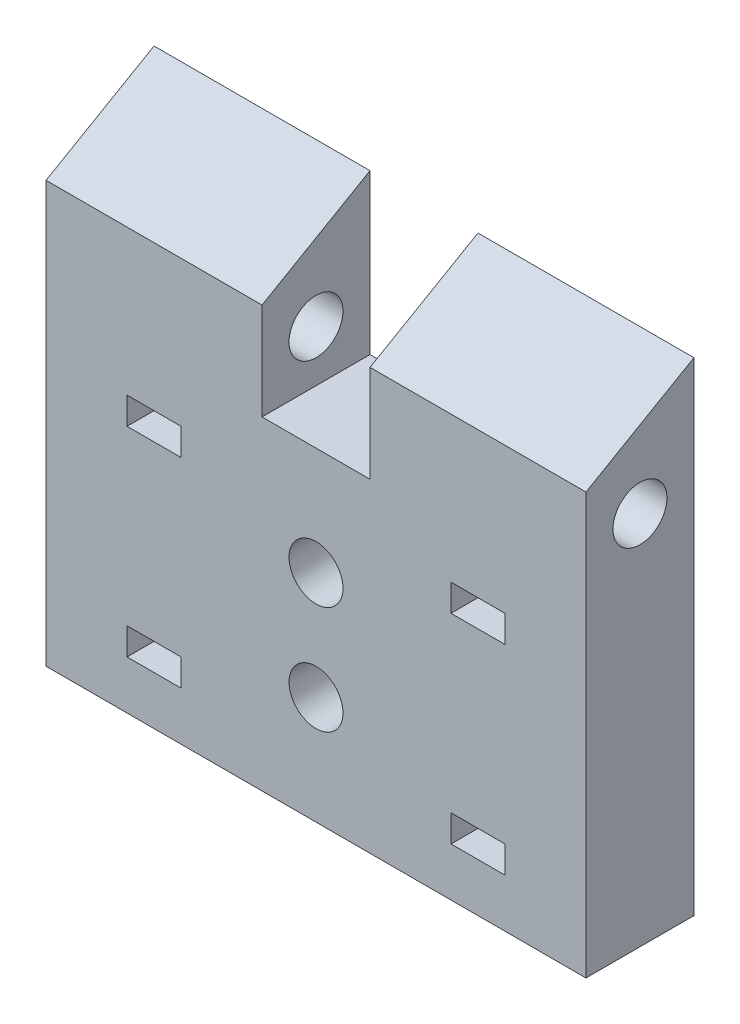
from build123d import *

# Parameters (mm, degrees)
ESQUISSE1_R             = 2.5
BOSS_EXTRU_1_DEPTH      = 10
ENL_V_MAT_EXTRU_1_REACH = 61.034
ESQUISSE2_R             = 2.5
ESQUISSE3_W             = 5
ESQUISSE3_H             = 2.5
ENL_V_MAT_EXTRU_2_DEPTH = 10


with BuildPart() as part:
    # Esquisse1 → Boss.-Extru.1 (new body)
    with BuildSketch(Plane.XY):
        Polygon((-25, -15), (-5, -15), (5, -15), (25, -15), (25, 29.75), (5, 29.75), (5, 15), (-5, 15), (-5, 29.75), (-25, 29.75), align=None)
        with Locations((0, -5)):
            Circle(ESQUISSE1_R, mode=Mode.SUBTRACT)
        with Locations((0, 5)):
            Circle(ESQUISSE1_R, mode=Mode.SUBTRACT)
    extrude(amount=BOSS_EXTRU_1_DEPTH)

    # Enlèv. mat.-Extru.1: up to this face of the body (flat: up to its plane)
    enl_v_mat_extru_1_end = Plane(part.part.faces().sort_by_distance((25, 7.375, 5))[0])
    # Esquisse2 → Enlèv. mat.-Extru.1 (cut, up to the picked face)
    with BuildSketch(Plane.ZY.offset(25), mode=Mode.PRIVATE) as enl_v_mat_extru_1_sk1:
        with Locations((5, 19.75)):
            Circle(ESQUISSE2_R)
    enl_v_mat_extru_1_tool1 = split(extrude(enl_v_mat_extru_1_sk1.sketch, amount=-ENL_V_MAT_EXTRU_1_REACH, mode=Mode.PRIVATE), bisect_by=enl_v_mat_extru_1_end, keep=Keep.BOTH, mode=Mode.PRIVATE)
    # Esquisse2 → Enlèv. mat.-Extru.1 (cut, up to the picked face)
    with BuildSketch(Plane.ZY.offset(25), mode=Mode.PRIVATE) as enl_v_mat_extru_1_sk2:
        Polygon((0, 29.75), (10, 29.75), (10, 23.976497308), align=None)
    enl_v_mat_extru_1_tool2 = split(extrude(enl_v_mat_extru_1_sk2.sketch, amount=-ENL_V_MAT_EXTRU_1_REACH, mode=Mode.PRIVATE), bisect_by=enl_v_mat_extru_1_end, keep=Keep.BOTH, mode=Mode.PRIVATE)
    add(enl_v_mat_extru_1_tool1.solids().sort_by(Axis((-25, 19.75, 5), (1, 0, 0)))[0], mode=Mode.SUBTRACT)
    add(enl_v_mat_extru_1_tool2.solids().sort_by(Axis((-25, 27.825499, 6.666667), (1, 0, 0)))[0], mode=Mode.SUBTRACT)

    # Esquisse3 → Enlèv. mat.-Extru.2 (cut)
    with BuildSketch(Plane.XY.offset(10)):
        with Locations((-15, 9.25)):
            Rectangle(ESQUISSE3_W, ESQUISSE3_H)
        with Locations((-15, -9.25)):
            Rectangle(ESQUISSE3_W, ESQUISSE3_H)
        with Locations((15, -9.25)):
            Rectangle(ESQUISSE3_W, ESQUISSE3_H)
        with Locations((15, 9.25)):
            Rectangle(ESQUISSE3_W, ESQUISSE3_H)
    extrude(amount=-ENL_V_MAT_EXTRU_2_DEPTH, mode=Mode.SUBTRACT)


solid = part.part
